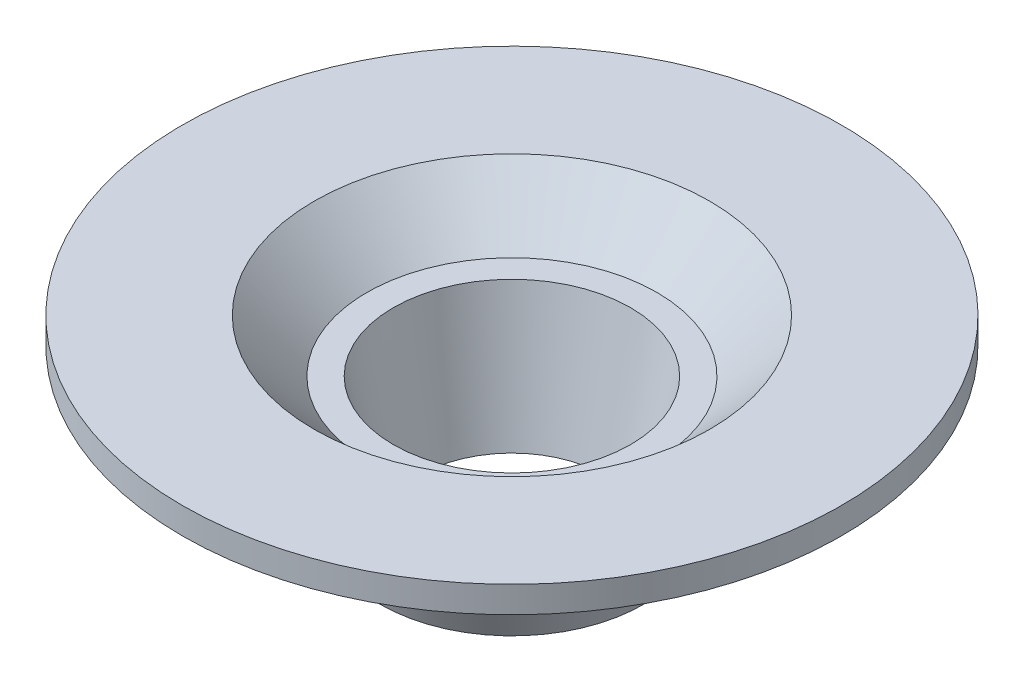
from build123d import *


with BuildPart() as part:
    # Sketch1 → Revolve1 (revolve)
    with BuildSketch(Plane(origin=(0, 0, 0), x_dir=(0, 0, -1), z_dir=(1, 0, 0)), mode=Mode.PRIVATE) as revolve1_sk:
        Polygon((4.5, 0), (3.496943494, -5), (4.996943494, -5), (6.5, -1), (8.5, -1), (10.5, 1), (12.5, 1), (12.5, 2), (7.5, 2), (5.5, 0), align=None)
    revolve(revolve1_sk.sketch.rotate(Axis((0, 0, 0), (0, -1, 0)), 180), axis=Axis((0, 0, 0), (0, -1, 0)))


solid = part.part
